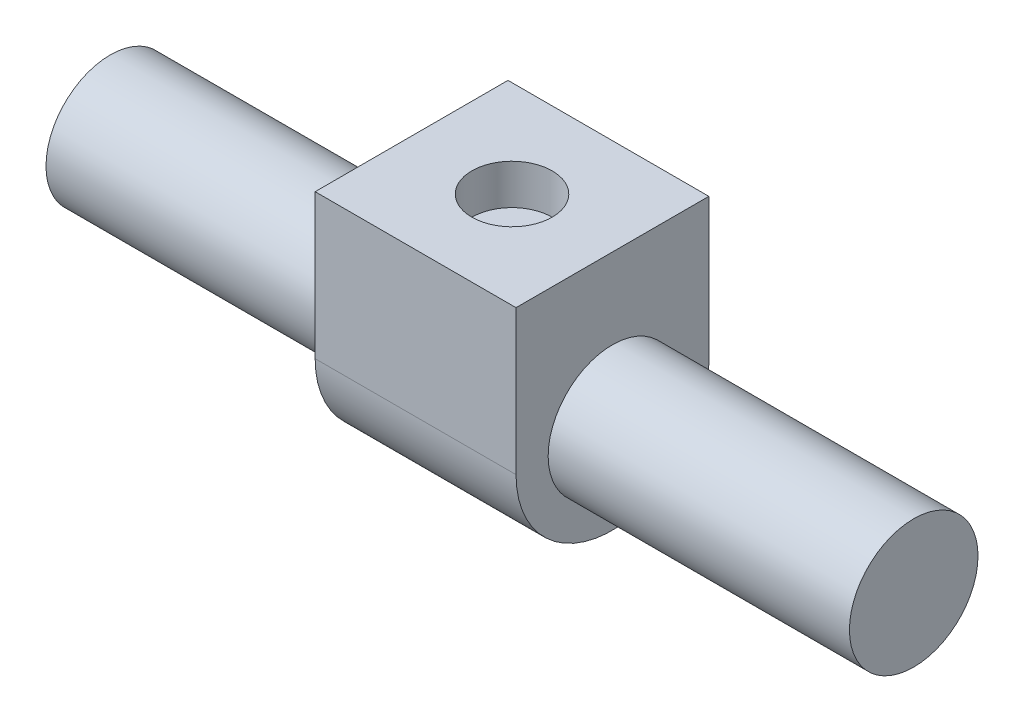
from build123d import *

# Parameters (mm, degrees)
BOSS_EXTRUDE1_DEPTH = 12.5
SKETCH2_R           = 8
BOSS_EXTRUDE2_DEPTH = 50
SKETCH3_R           = 5
CUT_EXTRUDE1_DEPTH  = 5


with BuildPart() as part:
    # Sketch1 → Boss-Extrude1 (new, symmetric)
    with BuildSketch(Plane(origin=(0, 0, 0), x_dir=(0, 0, -1), z_dir=(1, 0, 0))):
        with BuildLine():
            Line((-12, 0), (-12, 18))
            Line((-12, 18), (12, 18))
            Line((12, 18), (12, 0))
            ThreePointArc((12, 0), (0, -12), (-12, 0))
        make_face()
    extrude(amount=BOSS_EXTRUDE1_DEPTH, both=True)

    # Sketch2 → Boss-Extrude2 (add, symmetric)
    with BuildSketch(Plane(origin=(0, 0, 0), x_dir=(0, 0, -1), z_dir=(1, 0, 0))):
        with Locations(Location((0, 0, 0), (0, 0, 180))):
            Circle(SKETCH2_R)
    extrude(amount=BOSS_EXTRUDE2_DEPTH, both=True)

    # Sketch3 → Cut-Extrude1 (cut)
    with BuildSketch(Plane(origin=(0, 18, 0), x_dir=(1, 0, 0), z_dir=(0, 1, 0))):
        with Locations(Location((0, 0, 0), (0, 0, 270))):
            Circle(SKETCH3_R)
    extrude(amount=-CUT_EXTRUDE1_DEPTH, mode=Mode.SUBTRACT)


solid = part.part
